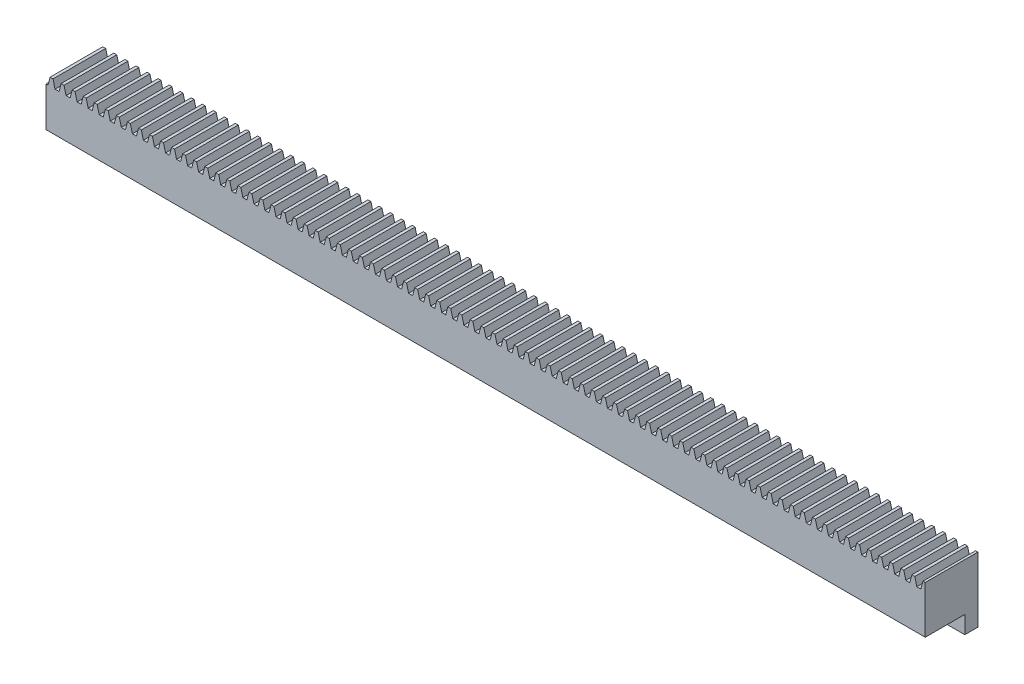
from build123d import *

# Parameters (mm, degrees)
BLANKSKE_W          = 200
BLANKSKE_H          = 10.8
BLANK_DEPTH         = 12
TOOTHCUTSIM_DEPTH   = 201.650541988
TEETHCUTS_COUNT     = 80
TEETHCUTS_PITCH     = 2.51327412
SKETCH1_W           = 200
SKETCH1_H           = 3
BOSS_EXTRUDE1_DEPTH = 4


with BuildPart() as part:
    # BlankSke → Blank (new body)
    with BuildSketch(Plane.XY):
        with Locations((100, 5.4)):
            Rectangle(BLANKSKE_W, BLANKSKE_H)
    extrude(amount=-BLANK_DEPTH)

    # TooCutSkeSim → ToothCutSim (cut, through all)
    with BuildSketch(Plane.XY):
        Polygon((0.459700946, 9), (-0.459700946, 9), (-0.931781484, 10.8254), (0.931781484, 10.8254), align=None)
    toothcutsim = extrude(amount=-TOOTHCUTSIM_DEPTH, mode=Mode.SUBTRACT)

    # TeethCuts: ToothCutSim ×80
    with Locations(*[(i * TEETHCUTS_PITCH, 0, 0) for i in range(1, TEETHCUTS_COUNT)]):
        add(toothcutsim, mode=Mode.SUBTRACT)

    # Sketch1 → Boss-Extrude1 (add)
    with BuildSketch(Plane.XZ):
        with Locations((100, -10.5)):
            Rectangle(SKETCH1_W, SKETCH1_H)
    extrude(amount=BOSS_EXTRUDE1_DEPTH)


solid = part.part
